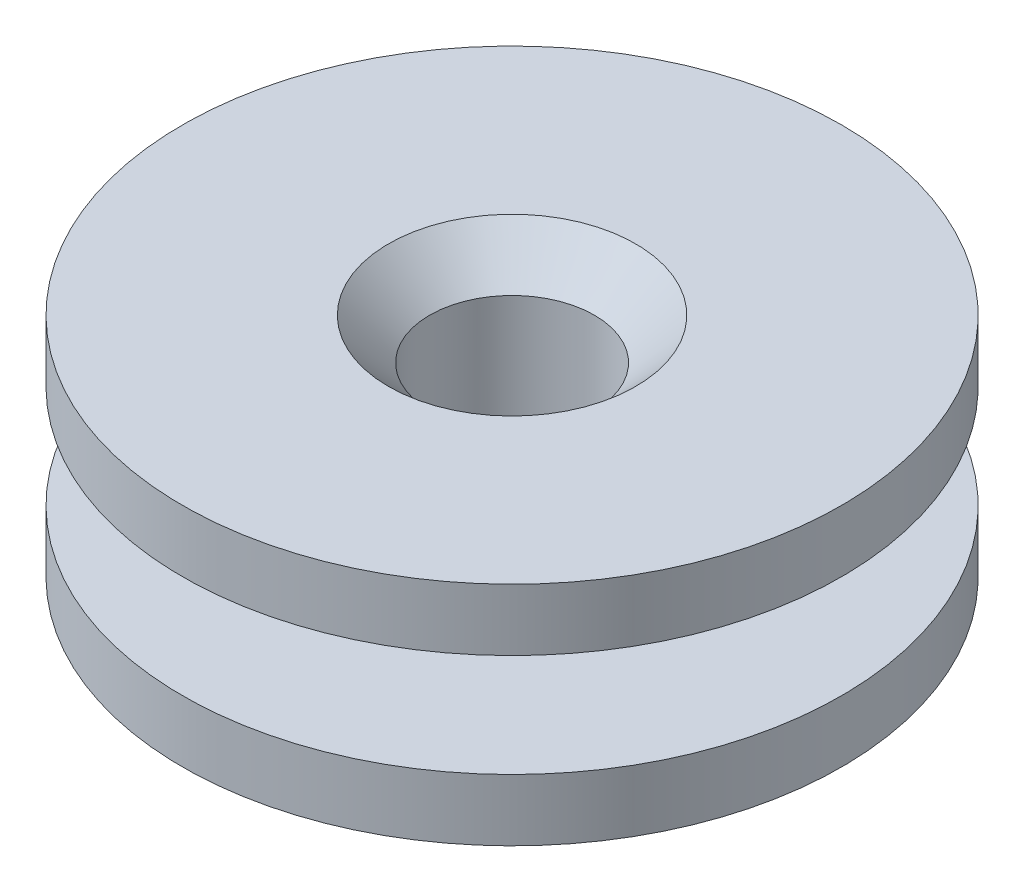
from build123d import *

# Parameters (mm, degrees)
CHAMFER1_SIZE = 2


with BuildPart() as part:
    # Sketch1 → Revolve1 (revolve)
    with BuildSketch(Plane.XY, mode=Mode.PRIVATE) as revolve1_sk:
        Polygon((4, 0), (4, 11), (16, 11), (16, 8), (8, 8), (8, 3), (16, 3), (16, 0), align=None)
    revolve(revolve1_sk.sketch.rotate(Axis((0, 0, 0), (0, 1, 0)), 90), axis=Axis((0, 0, 0), (0, 1, 0)))

    # Chamfer1
    chamfer1_edges = [part.edges().sort_by_distance(p)[0] for p in [
        (0, 0, 4),
        (0, 11, 4),
    ]]
    chamfer(chamfer1_edges, length=CHAMFER1_SIZE)


solid = part.part
